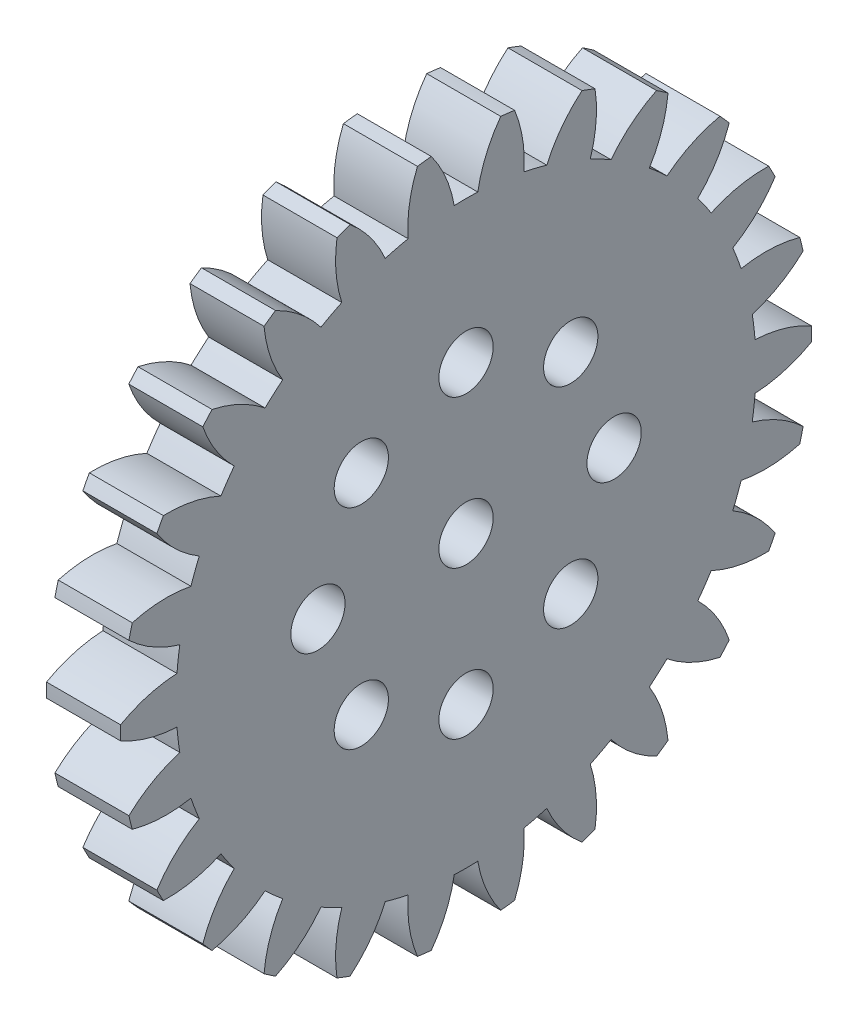
from build123d import *

# Parameters (mm, degrees)
BASPROSKE_W         = 3
BASPROSKE_H         = 14
TOOTHCUT_DEPTH      = 21.024984395
TEETHCUTS_COUNT     = 26
TEETHCUTS_ANGLE     = 346.153846154
BORSKE_R            = 4
BORE_DEPTH          = 50.0000508
EXTRUDE_START       = -3
SKETCH_1_R          = 4
EXTRUDE_1_DEPTH     = 3
SKETCH_2_R          = 1.1
CUT_EXTRUDE_1_DEPTH = 3


with BuildPart() as part:
    # BasProSke → Base-Revolve (revolve)
    with BuildSketch(Plane(origin=(0, 0, 0), x_dir=(1, 0, 0), z_dir=(0, 1, 0)), mode=Mode.PRIVATE) as base_revolve_sk:
        with Locations((1.5, 7)):
            Rectangle(BASPROSKE_W, BASPROSKE_H)
    revolve(base_revolve_sk.sketch.rotate(Axis((-10, 0, 0), (1, 0, 0)), 180), axis=Axis((-10, 0, 0), (1, 0, 0)))

    # TooCutSke → ToothCut (cut, through all)
    with BuildSketch(Plane(origin=(0, 0, 0), x_dir=(0, 0, -1), z_dir=(1, 0, 0))):
        with BuildLine():
            ThreePointArc((0.476965065, 11.739314517), (0, 11.749), (-0.476965065, 11.739314517))
            ThreePointArc((-0.476965065, 11.739314517), (-0.82065865, 12.901686978), (-1.424117301, 13.952911348))
            ThreePointArc((-1.424117301, 13.952911348), (0, 14.0254), (1.424117301, 13.952911348))
            ThreePointArc((1.424117301, 13.952911348), (0.82065865, 12.901686978), (0.476965065, 11.739314517))
        make_face()
    toothcut = extrude(amount=TOOTHCUT_DEPTH, mode=Mode.SUBTRACT)

    # TeethCuts: ToothCut ×26 about axis
    teethcuts_axis = Axis((-10, 0, 0), (1, 0, 0))
    for i in range(1, TEETHCUTS_COUNT):
        add(toothcut.rotate(teethcuts_axis, i * TEETHCUTS_ANGLE / (TEETHCUTS_COUNT - 1)), mode=Mode.SUBTRACT)

    # BorSke → Bore (cut, symmetric)
    with BuildSketch(Plane(origin=(0, 0, 0), x_dir=(0, 0, -1), z_dir=(1, 0, 0))):
        with Locations(Location((0, 0, 0), (0, 0, 180))):
            Circle(BORSKE_R)
    extrude(amount=BORE_DEPTH, both=True, mode=Mode.SUBTRACT)

    # ｽｹｯﾁ1 → ﾎﾞｽ - 押し出し1 (add)
    with BuildSketch(Plane.ZY.offset(EXTRUDE_START)):
        Circle(SKETCH_1_R)
    extrude(amount=EXTRUDE_1_DEPTH)

    # ｽｹｯﾁ2 → ｶｯﾄ - 押し出し1 (cut)
    with BuildSketch(Plane.ZY):
        Circle(SKETCH_2_R)
        with Locations((0, 6)):
            Circle(SKETCH_2_R)
        with Locations((4.242640687, 4.242640687)):
            Circle(SKETCH_2_R)
        with Locations((6, 0)):
            Circle(SKETCH_2_R)
        with Locations((4.242640687, -4.242640687)):
            Circle(SKETCH_2_R)
        with Locations((0, -6)):
            Circle(SKETCH_2_R)
        with Locations((-4.242640687, -4.242640687)):
            Circle(SKETCH_2_R)
        with Locations((-6, 0)):
            Circle(SKETCH_2_R)
        with Locations((-4.242640687, 4.242640687)):
            Circle(SKETCH_2_R)
    extrude(amount=-CUT_EXTRUDE_1_DEPTH, mode=Mode.SUBTRACT)


solid = part.part
